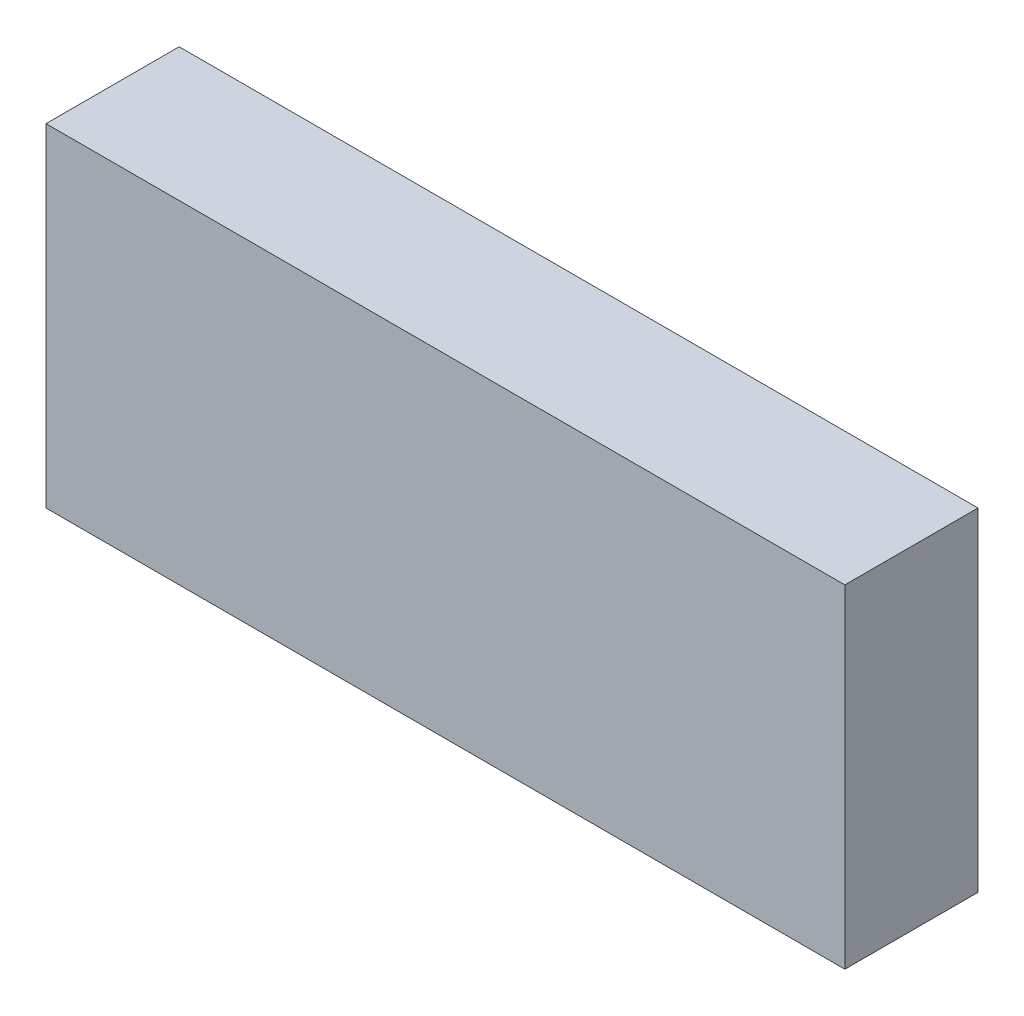
from build123d import *

# Parameters (mm, degrees)
CROQUIS1_W              = 60
CROQUIS1_H              = 25
SALIENTE_EXTRUIR1_DEPTH = 10


with BuildPart() as part:
    # Croquis1 → Saliente-Extruir1 (new body)
    with BuildSketch(Plane.XY):
        Rectangle(CROQUIS1_W, CROQUIS1_H)
    extrude(amount=SALIENTE_EXTRUIR1_DEPTH)


solid = part.part
